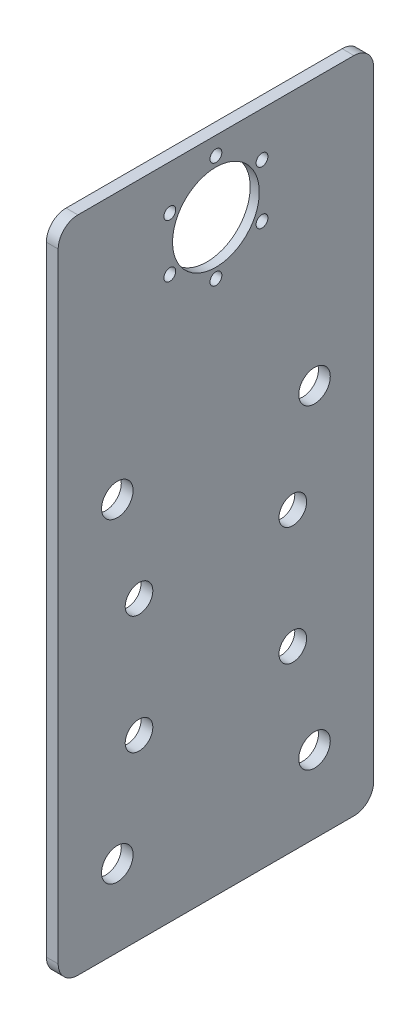
from build123d import *

# Parameters (mm, degrees)
BOSS_EXTRUDE1_DEPTH = 40
SKETCH16_R          = 3.5
SKETCH16_R_2        = 4
CUT_EXTRUDE5_DEPTH  = 150.212253532
SKETCH18_R          = 1.5
SKETCH18_R_2        = 11
CUT_EXTRUDE6_DEPTH  = 150.212253532
SKETCH19_R          = 16
CUT_EXTRUDE7_DEPTH  = 0.7
FILLET1_R           = 5


with BuildPart() as part:
    # Sketch1 → Boss-Extrude1 (new, symmetric)
    with BuildSketch(Plane.XY):
        Polygon((0, -23.280493307), (0, 106.719506693), (0, 143.719506693), (3, 143.719506693), (3, 103.719506693), (3, -23.280493307), align=None)
    extrude(amount=BOSS_EXTRUDE1_DEPTH, both=True)

    # Sketch16 → Cut-Extrude5 (cut, through all)
    with BuildSketch(Plane(origin=(3, 0, 0), x_dir=(0, 0, -1), z_dir=(1, 0, 0))):
        with Locations((-19.5, 21.719506693)):
            Circle(SKETCH16_R)
        with Locations((19.5, 21.719506693)):
            Circle(SKETCH16_R)
        with Locations((19.5, 51.719506693)):
            Circle(SKETCH16_R)
        with Locations((-19.5, 51.719506693)):
            Circle(SKETCH16_R)
        with Locations((25, 76.219506693)):
            Circle(SKETCH16_R_2)
        with Locations((-25, 76.219506693)):
            Circle(SKETCH16_R_2)
        with Locations((-25, -3.780493307)):
            Circle(SKETCH16_R_2)
        with Locations((25, -3.780493307)):
            Circle(SKETCH16_R_2)
    extrude(amount=-CUT_EXTRUDE5_DEPTH, mode=Mode.SUBTRACT)

    # Sketch18 → Cut-Extrude6 (cut, through all)
    with BuildSketch(Plane.ZY):
        with Locations((0, 139.219506693)):
            Circle(SKETCH18_R)
        with Locations((0, 125.719506693)):
            Circle(SKETCH18_R_2)
        with Locations((11.691342951, 132.469506693)):
            Circle(SKETCH18_R)
        with Locations((11.691342951, 118.969506693)):
            Circle(SKETCH18_R)
        with Locations((0, 112.219506693)):
            Circle(SKETCH18_R)
        with Locations((-11.691342951, 118.969506693)):
            Circle(SKETCH18_R)
        with Locations((-11.691342951, 132.469506693)):
            Circle(SKETCH18_R)
    extrude(amount=-CUT_EXTRUDE6_DEPTH, mode=Mode.SUBTRACT)

    # Sketch19 → Cut-Extrude7 (cut)
    with BuildSketch(Plane.ZY):
        with Locations((0, 125.719506693)):
            Circle(SKETCH19_R)
    extrude(amount=-CUT_EXTRUDE7_DEPTH, mode=Mode.SUBTRACT)

    # Fillet1
    fillet1_edges = [part.edges().sort_by_distance(p)[0] for p in [
        (1.5, 143.719506693, 40),
        (1.5, -23.280493307, 40),
        (1.5, 143.719506693, -40),
        (1.5, -23.280493307, -40),
    ]]
    fillet(fillet1_edges, radius=FILLET1_R)


solid = part.part
